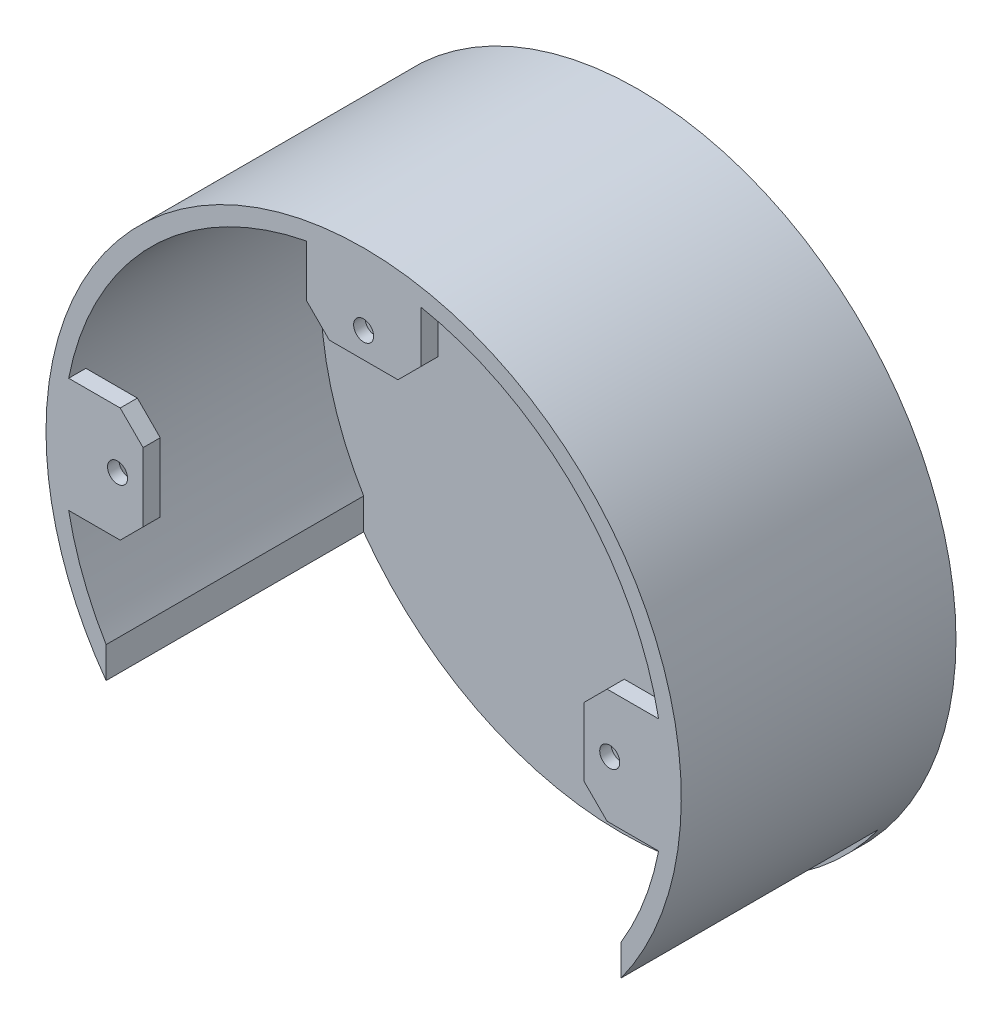
from build123d import *

# Parameters (mm, degrees)
SKETCH1_R           = 55.5
SKETCH1_R_2         = 52.5
BOSS_EXTRUDE1_DEPTH = 45
BOSS_EXTRUDE2_START = 3
SKETCH2_R           = 55.5
SKETCH2_R_2         = 5.1
SKETCH2_R_3         = 1.7
BOSS_EXTRUDE2_DEPTH = 3
SKETCH3_W           = 90
SKETCH3_H           = 75.046354864
CUT_EXTRUDE1_DEPTH  = 91.4737531
BOSS_EXTRUDE3_START = -3
SKETCH4_R           = 1.75
BOSS_EXTRUDE3_DEPTH = 3
CHAMFER1_SIZE       = 4
SKETCH8_R           = 1.7
CUT_EXTRUDE2_DEPTH  = 10
SKETCH9_R           = 3.25
CUT_EXTRUDE3_DEPTH  = 1


with BuildPart() as part:
    # Sketch1 → Boss-Extrude1 (new body)
    with BuildSketch(Plane.XY):
        with Locations(Location((0, 0, 0), (0, 0, 180))):
            Circle(SKETCH1_R)
        with Locations(Location((0, 0, 0), (0, 0, 180))):
            Circle(SKETCH1_R_2, mode=Mode.SUBTRACT)
    extrude(amount=BOSS_EXTRUDE1_DEPTH)

    # Sketch2 → Boss-Extrude2 (add)
    with BuildSketch(Plane(origin=(0, 0, 0), x_dir=(-1, 0, 0), z_dir=(0, 0, -1)).offset(BOSS_EXTRUDE2_START)):
        Circle(SKETCH2_R)
        Circle(SKETCH2_R_2, mode=Mode.SUBTRACT)
        with Locations((-10.45, 0)):
            Circle(SKETCH2_R_3, mode=Mode.SUBTRACT)
        with Locations((10.45, 0)):
            Circle(SKETCH2_R_3, mode=Mode.SUBTRACT)
        with Locations((0, 10.45)):
            Circle(SKETCH2_R_3, mode=Mode.SUBTRACT)
        with Locations((0, -10.45)):
            Circle(SKETCH2_R_3, mode=Mode.SUBTRACT)
    extrude(amount=-BOSS_EXTRUDE2_DEPTH)

    # Sketch3 → Cut-Extrude1 (cut, through all)
    with BuildSketch(Plane(origin=(0, 0, 0), x_dir=(1, 0, 0), z_dir=(0, 1, 0))):
        with Locations((0, -37.523177432)):
            Rectangle(SKETCH3_W, SKETCH3_H)
    extrude(amount=-CUT_EXTRUDE1_DEPTH, mode=Mode.SUBTRACT)

    # Sketch4 → Boss-Extrude3 (add)
    # profile 1 of 3: a face of its own
    with BuildSketch(Plane.XY.offset(45).offset(BOSS_EXTRUDE3_START)):
        with BuildLine():
            Line((51.53882032, -10), (38.53882032, -10))
            Line((38.53882032, -10), (38.53882032, 10))
            Line((38.53882032, 10), (51.53882032, 10))
            ThreePointArc((51.53882032, 10), (52.5, 0), (51.53882032, -10))
        make_face()
        with Locations((43, 0)):
            Circle(SKETCH4_R, mode=Mode.SUBTRACT)
    # profile 2 of 3: a face of its own
    with BuildSketch(Plane.XY.offset(45).offset(BOSS_EXTRUDE3_START)):
        with BuildLine():
            Line((-51.53882032, 10), (-38.53882032, 10))
            Line((-38.53882032, 10), (-38.53882032, -10))
            Line((-38.53882032, -10), (-51.53882032, -10))
            ThreePointArc((-51.53882032, -10), (-52.5, 0), (-51.53882032, 10))
        make_face()
        with Locations((-43, 0)):
            Circle(SKETCH4_R, mode=Mode.SUBTRACT)
    # profile 3 of 3: a face of its own
    with BuildSketch(Plane.XY.offset(45).offset(BOSS_EXTRUDE3_START)):
        with BuildLine():
            Line((10, 51.53882032), (10, 38.53882032))
            Line((10, 38.53882032), (-10, 38.53882032))
            Line((-10, 38.53882032), (-10, 51.53882032))
            ThreePointArc((-10, 51.53882032), (0, 52.5), (10, 51.53882032))
        make_face()
        with Locations((0, 43)):
            Circle(SKETCH4_R, mode=Mode.SUBTRACT)
    extrude(amount=BOSS_EXTRUDE3_DEPTH)

    # Chamfer1
    chamfer1_edges = [part.edges().sort_by_distance(p)[0] for p in [
        (38.53882032, -10, 43.5),
        (38.53882032, 10, 43.5),
        (-38.53882032, 10, 43.5),
        (-38.53882032, -10, 43.5),
        (10, 38.53882032, 43.5),
        (-10, 38.53882032, 43.5),
    ]]
    chamfer(chamfer1_edges, length=CHAMFER1_SIZE)

    # Sketch8 → Cut-Extrude2 (cut)
    with BuildSketch(Plane(origin=(0, 0, -3), x_dir=(-1, 0, 0), z_dir=(0, 0, -1))):
        with Locations((34.648232278, 34.648232278)):
            Circle(SKETCH8_R)
        with Locations((16.970562748, 16.970562748)):
            Circle(SKETCH8_R)
        with Locations((-16.970562748, 16.970562748)):
            Circle(SKETCH8_R)
        with Locations((-34.648232278, 34.648232278)):
            Circle(SKETCH8_R)
        with Locations((0, -48)):
            Circle(SKETCH8_R)
        with Locations((-48, 0)):
            Circle(SKETCH8_R)
        with Locations((0, 48)):
            Circle(SKETCH8_R)
        with Locations((48, 0)):
            Circle(SKETCH8_R)
    extrude(amount=-CUT_EXTRUDE2_DEPTH, mode=Mode.SUBTRACT)

    # Sketch9 → Cut-Extrude3 (cut)
    with BuildSketch(Plane(origin=(0, 0, 42), x_dir=(-1, 0, 0), z_dir=(0, 0, -1))):
        with Locations((-43, 0)):
            Circle(SKETCH9_R)
        with Locations((0, 43)):
            Circle(SKETCH9_R)
        with Locations((43, 0)):
            Circle(SKETCH9_R)
    extrude(amount=-CUT_EXTRUDE3_DEPTH, mode=Mode.SUBTRACT)


solid = part.part
